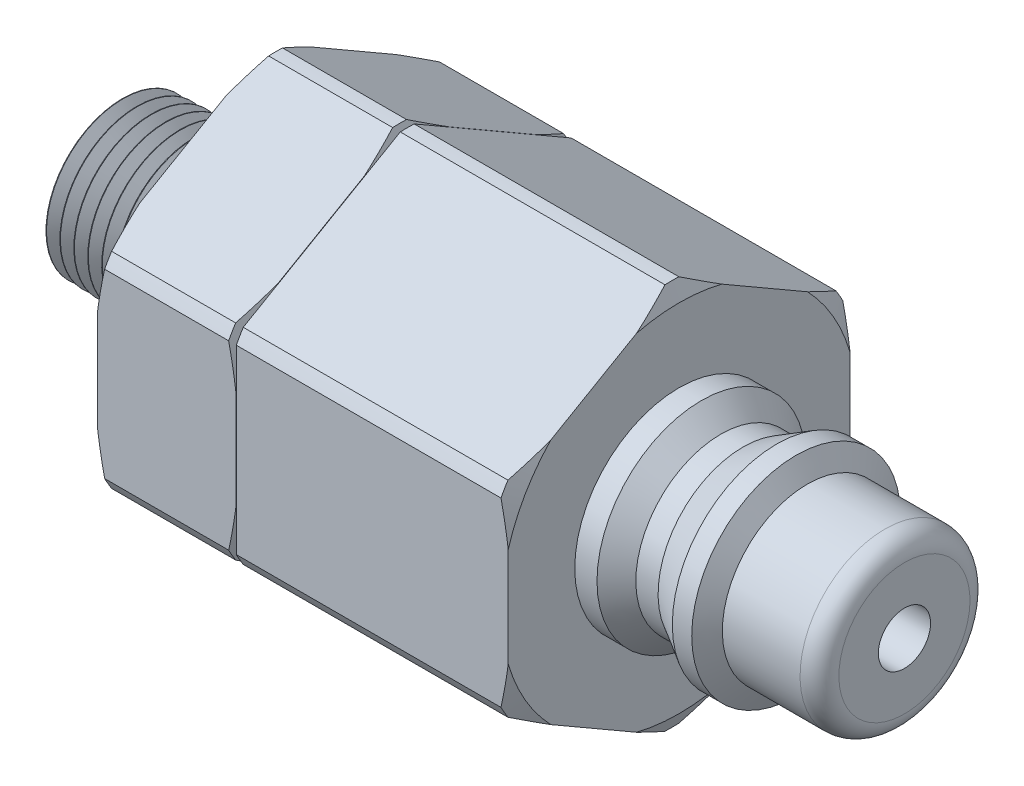
from build123d import *

# Parameters (mm, degrees)
SKETCH6_W      = 11.300333551
SKETCH6_H      = 15.496408613
EXTRUDE1_DEPTH = 26.86304
FILLET1_R      = 1.27


with BuildPart() as part:
    # Sketch1 → Revolve1 (revolve)
    with BuildSketch(Plane.XY):
        Polygon((0, 0), (0, 4.202548436), (0.016953331, 4.234153018), (0.42773912, 4.999944315), (0.463586157, 5.001064591), (0.921387979, 4.262418014), (0.957235016, 4.26353829), (1.368020805, 5.029329586), (1.403867842, 5.030449862), (1.861669664, 4.291803285), (1.897516701, 4.292923561), (2.30830249, 5.058714857), (2.344149527, 5.059835133), (2.801951349, 4.321188556), (2.837798386, 4.322308832), (3.248584175, 5.088100128), (3.284431212, 5.089220404), (3.742233034, 4.350573827), (3.778080071, 4.351694103), (4.18886586, 5.1174854), (4.224712897, 5.118605675), (4.682514719, 4.379959098), (4.718361756, 4.381079374), (5.129147545, 5.146870671), (5.164994582, 5.147990947), (5.622796404, 4.409344369), (5.658643441, 4.410464645), (6.06942923, 5.176255942), (6.105276267, 5.177376218), (6.563078089, 4.43872964), (6.598925126, 4.439849916), (7.009710915, 5.205641213), (7.045557952, 5.206761489), (7.503359774, 4.468114911), (7.539206811, 4.469235187), (7.9499926, 5.235026484), (7.985839637, 5.23614676), (8.443641459, 4.497500182), (8.479488496, 4.498620458), (8.890274285, 5.264411755), (8.926121322, 5.265532031), (9.383923144, 4.526885454), (9.419770181, 4.528005729), (9.83055597, 5.293797026), (9.866403007, 5.294917302), (10.324204829, 4.556270725), (10.360051866, 4.557391001), (10.770837655, 5.323182297), (10.806684692, 5.324302573), (11.264486514, 4.585655996), (11.300333551, 4.586776272), (11.300333551, 0), align=None)
    revolve(axis=Axis((0, 0, 0), (-1, 0, 0)))

    # Sketch5 → Cut-Revolve2 (revolve, cut)
    with BuildSketch(Plane.XY, mode=Mode.PRIVATE) as cut_revolve2_sk:
        Polygon((9.96696, 0), (9.96696, 5.298059865), (11.300333551, 5.339729871), (11.300333551, 0), align=None)
    revolve(cut_revolve2_sk.sketch.rotate(Axis((0, 0, 0), (-1, 0, 0)), 180), axis=Axis((0, 0, 0), (-1, 0, 0)), mode=Mode.SUBTRACT)

    # Sketch6 → Cut-Revolve3 (revolve, cut)
    with BuildSketch(Plane.XY, mode=Mode.PRIVATE) as cut_revolve3_sk:
        with Locations((5.650166776, 12.891704307)):
            Rectangle(SKETCH6_W, SKETCH6_H)
    revolve(cut_revolve3_sk.sketch.rotate(Axis((0, 0, 0), (1, 0, 0)), 180), axis=Axis((0, 0, 0), (1, 0, 0)), mode=Mode.SUBTRACT)

    # Sketch7 → Revolve2 (revolve)
    with BuildSketch(Plane.XY, mode=Mode.PRIVATE) as revolve2_sk:
        Polygon((6.7056, 4.202548436), (9.96696, 5.1435), (9.96696, 4.202548436), align=None)
    revolve(revolve2_sk.sketch.rotate(Axis((0, 0, 0), (1, 0, 0)), 180), axis=Axis((0, 0, 0), (1, 0, 0)))

    # Sketch8 → Extrude1 (add)
    with BuildSketch(Plane(origin=(9.96696, 0, 0), x_dir=(0, 0, -1), z_dir=(1, 0, 0))):
        Polygon((0, 12.904933217), (-11.176, 6.452466608), (-11.176, -6.452466608), (0, -12.904933217), (11.176, -6.452466608), (11.176, 6.452466608), align=None)
    extrude(amount=EXTRUDE1_DEPTH)

    # Sketch9 → Cut-Revolve4 (revolve, cut)
    with BuildSketch(Plane.XY, mode=Mode.PRIVATE) as cut_revolve4_sk:
        Polygon((36.83, 11.634933217), (36.356231419, 12.650933217), (10.440728581, 12.650933217), (9.96696, 11.634933217), (9.96696, 12.904933217), (36.83, 12.904933217), align=None)
    revolve(cut_revolve4_sk.sketch.rotate(Axis((0, 0, 0), (1, 0, 0)), 180), axis=Axis((0, 0, 0), (1, 0, 0)), mode=Mode.SUBTRACT)

    # Sketch10 → Revolve3 (revolve)
    with BuildSketch(Plane.XY, mode=Mode.PRIVATE) as revolve3_sk:
        Polygon((36.83, 0), (51.562, 0), (51.562, 5.55625), (45.212, 5.55625), (44.478765158, 6.82625), (43.208765158, 6.82625), (41.009060633, 5.55625), (39.554530316, 5.55625), (38.284530316, 6.82625), (36.83, 6.82625), align=None)
    revolve(revolve3_sk.sketch.rotate(Axis((0, 0, 0), (-1, 0, 0)), 90), axis=Axis((0, 0, 0), (-1, 0, 0)))

    # Fillet1
    fillet1_edges = [part.edges().sort_by_distance(p)[0] for p in [
        (51.562, 0, 5.55625),
    ]]
    fillet(fillet1_edges, radius=FILLET1_R)

    # Sketch11 → Cut-Revolve5 (revolve, cut)
    with BuildSketch(Plane.XY):
        Polygon((11.300333551, 3.4163), (36.83, 1.70815), (51.562, 1.70815), (51.562, 0), (6.7056, 0), (0, 0), (0, 3.4163), align=None)
    revolve(axis=Axis((0, 0, 0), (-1, 0, 0)), mode=Mode.SUBTRACT)

    # Sketch12 → Cut-Revolve6 (revolve, cut)
    with BuildSketch(Plane.XY, mode=Mode.PRIVATE) as cut_revolve6_sk:
        Polygon((19.0246, 11.634933217), (18.432389274, 12.904933217), (19.05, 12.904933217), (19.05, 5.1435), (19.0246, 5.1435), align=None)
    revolve(cut_revolve6_sk.sketch.rotate(Axis((0, 0, 0), (1, 0, 0)), 270), axis=Axis((0, 0, 0), (1, 0, 0)), mode=Mode.SUBTRACT)


solid = part.part
